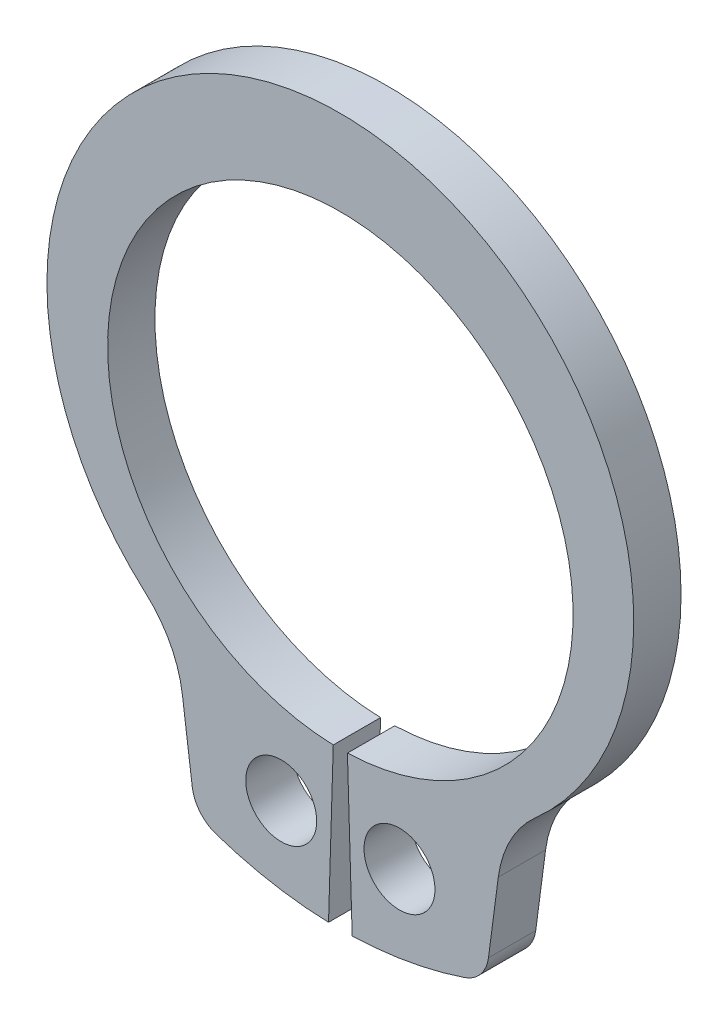
from build123d import *

# Parameters (mm, degrees)
BODYSKE_R  = 0.75
BODY_DEPTH = 1


with BuildPart() as part:
    # BodySke → Body (new body)
    with BuildSketch(Plane.XY):
        with BuildLine():
            Line((0.149635036, -4.917724002), (0.25, -8.216197417))
            ThreePointArc((0.25, -8.216197417), (1.454180899, -8.090349678), (2.626813498, -7.788982658))
            ThreePointArc((2.626813498, -7.788982658), (2.966427195, -7.554677818), (3.13072438, -7.176203702))
            Line((3.13072438, -7.176203702), (3.338910124, -5.594875973))
            ThreePointArc((3.338910124, -5.594875973), (3.597477975, -4.785238431), (4.122315108, -4.116720467))
            ThreePointArc((4.122315108, -4.116720467), (0, 6.72), (-4.122315108, -4.116720467))
            ThreePointArc((-4.122315108, -4.116720467), (-3.597477975, -4.785238431), (-3.338910124, -5.594875973))
            Line((-3.338910124, -5.594875973), (-3.13072438, -7.176203702))
            ThreePointArc((-3.13072438, -7.176203702), (-2.966427195, -7.554677818), (-2.626813498, -7.788982658))
            ThreePointArc((-2.626813498, -7.788982658), (-1.454180899, -8.090349678), (-0.25, -8.216197417))
            Line((-0.25, -8.216197417), (-0.149635036, -4.917724002))
            ThreePointArc((-0.149635036, -4.917724002), (0, 4.92), (0.149635036, -4.917724002))
        make_face()
        with Locations((1.25, -6.490731854)):
            Circle(BODYSKE_R, mode=Mode.SUBTRACT)
        with Locations((-1.25, -6.490731854)):
            Circle(BODYSKE_R, mode=Mode.SUBTRACT)
    extrude(amount=-BODY_DEPTH)


solid = part.part
